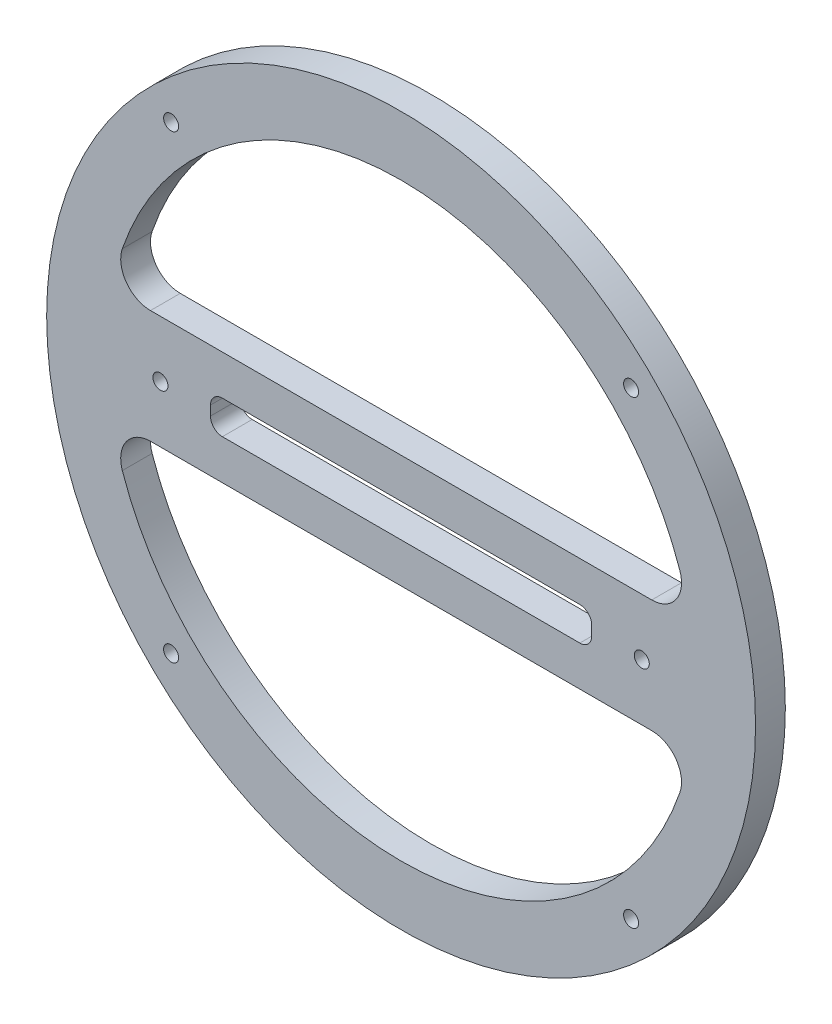
from build123d import *

# Parameters (mm, degrees)
SKETCH1_R           = 75.565
SKETCH1_R_2         = 1.6
BOSS_EXTRUDE1_DEPTH = 6.35


with BuildPart() as part:
    # Sketch1 → Boss-Extrude1 (new body)
    with BuildSketch(Plane.XY):
        Circle(SKETCH1_R)
        with Locations((-51.308, 0)):
            Circle(SKETCH1_R_2, mode=Mode.SUBTRACT)
        with Locations(Location((51.308, 0, 0), (0, 0, 180))):
            Circle(SKETCH1_R_2, mode=Mode.SUBTRACT)
        with Locations((49.032198421, 49.032198421)):
            Circle(SKETCH1_R_2, mode=Mode.SUBTRACT)
        with Locations((49.032198421, -49.032198421)):
            Circle(SKETCH1_R_2, mode=Mode.SUBTRACT)
        with Locations((-49.032198421, -49.032198421)):
            Circle(SKETCH1_R_2, mode=Mode.SUBTRACT)
        with Locations((-49.032198421, 49.032198421)):
            Circle(SKETCH1_R_2, mode=Mode.SUBTRACT)
        with BuildLine():
            Line((-53.430637279, 12.065), (53.430637279, 12.065))
            ThreePointArc((53.430637279, 12.065), (58.600806141, 14.728286839), (59.434079669, 20.484101124))
            ThreePointArc((59.434079669, 20.484101124), (0, 62.865), (-59.434079669, 20.484101124))
            ThreePointArc((-59.434079669, 20.484101124), (-58.600806141, 14.728286839), (-53.430637279, 12.065))
        make_face(mode=Mode.SUBTRACT)
        with BuildLine():
            Line((-53.430637279, -12.065), (53.430637279, -12.065))
            ThreePointArc((53.430637279, -12.065), (58.600806141, -14.728286839), (59.434079669, -20.484101124))
            ThreePointArc((59.434079669, -20.484101124), (0, -62.865), (-59.434079669, -20.484101124))
            ThreePointArc((-59.434079669, -20.484101124), (-58.600806141, -14.728286839), (-53.430637279, -12.065))
        make_face(mode=Mode.SUBTRACT)
        with BuildLine():
            Line((-38.1, -3.556), (38.1, -3.556))
            ThreePointArc((38.1, -3.556), (39.896051224, -2.812051224), (40.64, -1.016))
            Line((40.64, -1.016), (40.64, 1.016))
            ThreePointArc((40.64, 1.016), (39.896051224, 2.812051224), (38.1, 3.556))
            Line((38.1, 3.556), (-38.1, 3.556))
            ThreePointArc((-38.1, 3.556), (-39.896051224, 2.812051224), (-40.64, 1.016))
            Line((-40.64, 1.016), (-40.64, -1.016))
            ThreePointArc((-40.64, -1.016), (-39.896051224, -2.812051224), (-38.1, -3.556))
        make_face(mode=Mode.SUBTRACT)
    extrude(amount=-BOSS_EXTRUDE1_DEPTH)


solid = part.part
